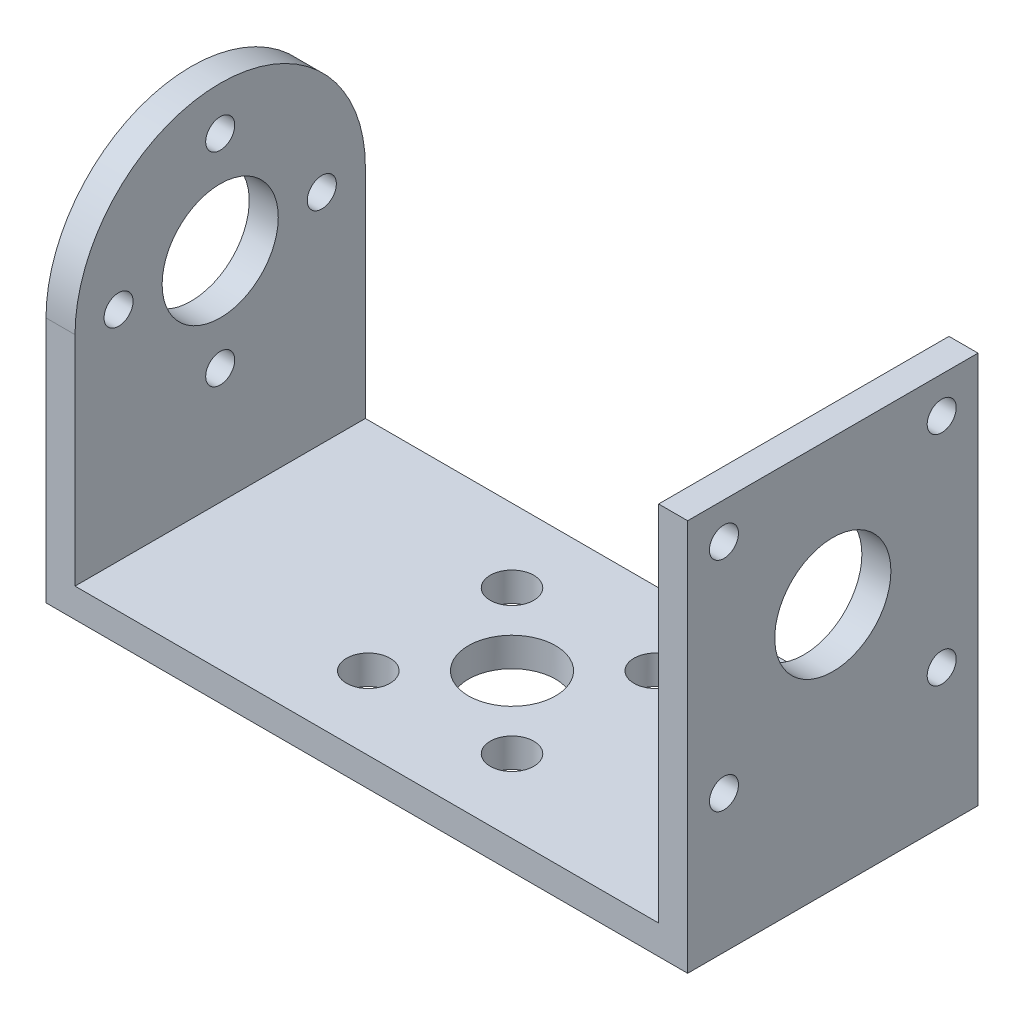
from build123d import *

# Parameters (mm, degrees)
SKETCH_1_W          = 44.2
SKETCH_1_H          = 20
EXTRUDE_1_DEPTH     = 2
CUT_EXTRUDE_1_REACH = 26.339
SKETCH_2_R          = 3
SKETCH_2_R_2        = 1.5
SKETCH_3_W          = 20
SKETCH_3_H          = 25
EXTRUDE_2_DEPTH     = 2
CUT_EXTRUDE_2_REACH = 54.751
SKETCH_4_R          = 1
CUT_EXTRUDE_3_REACH = 54.751
SKETCH_5_R          = 4
SKETCH_5_R_2        = 1


with BuildPart() as part:
    # 草图1 → 凸台-拉伸1 (new body)
    with BuildSketch(Plane(origin=(0, 0, 0), x_dir=(1, 0, 0), z_dir=(0, 1, 0))):
        Rectangle(SKETCH_1_W, SKETCH_1_H)
    extrude(amount=EXTRUDE_1_DEPTH)

    # 草图2 → 切除-拉伸1 (cut, up to next)
    with BuildSketch(Plane(origin=(0, 2, 0), x_dir=(1, 0, 0), z_dir=(0, 1, 0)), mode=Mode.PRIVATE) as cut_extrude_1_sk1:
        with Locations(Location((0, 0, 0), (0, 0, 270))):
            Circle(SKETCH_2_R)
    cut_extrude_1_tool1 = extrude(cut_extrude_1_sk1.sketch, amount=-CUT_EXTRUDE_1_REACH, mode=Mode.PRIVATE) & part.part
    # 草图2 → 切除-拉伸1 (cut, up to next)
    with BuildSketch(Plane(origin=(0, 2, 0), x_dir=(1, 0, 0), z_dir=(0, 1, 0)), mode=Mode.PRIVATE) as cut_extrude_1_sk2:
        with Locations(Location((4.949747468, -4.949747468, 0), (0, 0, 270))):
            Circle(SKETCH_2_R_2)
    cut_extrude_1_tool2 = extrude(cut_extrude_1_sk2.sketch, amount=-CUT_EXTRUDE_1_REACH, mode=Mode.PRIVATE) & part.part
    # 草图2 → 切除-拉伸1 (cut, up to next)
    with BuildSketch(Plane(origin=(0, 2, 0), x_dir=(1, 0, 0), z_dir=(0, 1, 0)), mode=Mode.PRIVATE) as cut_extrude_1_sk3:
        with Locations(Location((-4.949747468, -4.949747468, 0), (0, 0, 270))):
            Circle(SKETCH_2_R_2)
    cut_extrude_1_tool3 = extrude(cut_extrude_1_sk3.sketch, amount=-CUT_EXTRUDE_1_REACH, mode=Mode.PRIVATE) & part.part
    # 草图2 → 切除-拉伸1 (cut, up to next)
    with BuildSketch(Plane(origin=(0, 2, 0), x_dir=(1, 0, 0), z_dir=(0, 1, 0)), mode=Mode.PRIVATE) as cut_extrude_1_sk4:
        with Locations(Location((-4.949747468, 4.949747468, 0), (0, 0, 270))):
            Circle(SKETCH_2_R_2)
    cut_extrude_1_tool4 = extrude(cut_extrude_1_sk4.sketch, amount=-CUT_EXTRUDE_1_REACH, mode=Mode.PRIVATE) & part.part
    # 草图2 → 切除-拉伸1 (cut, up to next)
    with BuildSketch(Plane(origin=(0, 2, 0), x_dir=(1, 0, 0), z_dir=(0, 1, 0)), mode=Mode.PRIVATE) as cut_extrude_1_sk5:
        with Locations(Location((4.949747468, 4.949747468, 0), (0, 0, 270))):
            Circle(SKETCH_2_R_2)
    cut_extrude_1_tool5 = extrude(cut_extrude_1_sk5.sketch, amount=-CUT_EXTRUDE_1_REACH, mode=Mode.PRIVATE) & part.part
    add(cut_extrude_1_tool1.solids().sort_by_distance((0, 2, 0))[0], mode=Mode.SUBTRACT)
    add(cut_extrude_1_tool2.solids().sort_by_distance((4.949747, 2, 4.949747))[0], mode=Mode.SUBTRACT)
    add(cut_extrude_1_tool3.solids().sort_by_distance((-4.949747, 2, 4.949747))[0], mode=Mode.SUBTRACT)
    add(cut_extrude_1_tool4.solids().sort_by_distance((-4.949747, 2, -4.949747))[0], mode=Mode.SUBTRACT)
    add(cut_extrude_1_tool5.solids().sort_by_distance((4.949747, 2, -4.949747))[0], mode=Mode.SUBTRACT)

    # 草图3 → 凸台-拉伸2 (add)
    with BuildSketch(Plane.ZY.offset(22.1)):
        with Locations((0, 14.5)):
            Rectangle(SKETCH_3_W, SKETCH_3_H)
    extrude_2 = extrude(amount=-EXTRUDE_2_DEPTH)

    # 镜向2: 凸台-拉伸2 across plane
    add(extrude_2.mirror(Plane.ZY))

    # 草图4 → 切除-拉伸2 (cut, up to next)
    with BuildSketch(Plane.ZY.offset(22.1), mode=Mode.PRIVATE) as cut_extrude_2_sk1:
        with BuildLine():
            ThreePointArc((-10, 17), (-7.071067812, 24.071067812), (0, 27))
            Line((0, 27), (-10, 27))
            Line((-10, 27), (-10, 17))
        make_face()
    cut_extrude_2_tool1 = extrude(cut_extrude_2_sk1.sketch, amount=-CUT_EXTRUDE_2_REACH, mode=Mode.PRIVATE) & part.part
    # 草图4 → 切除-拉伸2 (cut, up to next)
    with BuildSketch(Plane.ZY.offset(22.1), mode=Mode.PRIVATE) as cut_extrude_2_sk2:
        with BuildLine():
            Line((10, 27), (0, 27))
            ThreePointArc((0, 27), (7.071067812, 24.071067812), (10, 17))
            Line((10, 17), (10, 27))
        make_face()
    cut_extrude_2_tool2 = extrude(cut_extrude_2_sk2.sketch, amount=-CUT_EXTRUDE_2_REACH, mode=Mode.PRIVATE) & part.part
    # 草图4 → 切除-拉伸2 (cut, up to next)
    with BuildSketch(Plane.ZY.offset(22.1), mode=Mode.PRIVATE) as cut_extrude_2_sk3:
        with BuildLine():
            ThreePointArc((1, 10), (0.707106781, 10.707106781), (0, 11))
            Line((0, 11), (0, 9))
            ThreePointArc((0, 9), (0.707106781, 9.292893219), (1, 10))
        make_face()
    cut_extrude_2_tool3 = extrude(cut_extrude_2_sk3.sketch, amount=-CUT_EXTRUDE_2_REACH, mode=Mode.PRIVATE) & part.part
    # 草图4 → 切除-拉伸2 (cut, up to next)
    with BuildSketch(Plane.ZY.offset(22.1), mode=Mode.PRIVATE) as cut_extrude_2_sk4:
        with BuildLine():
            Line((0, 9), (0, 11))
            ThreePointArc((0, 11), (-1, 10), (0, 9))
        make_face()
    cut_extrude_2_tool4 = extrude(cut_extrude_2_sk4.sketch, amount=-CUT_EXTRUDE_2_REACH, mode=Mode.PRIVATE) & part.part
    # 草图4 → 切除-拉伸2 (cut, up to next)
    with BuildSketch(Plane.ZY.offset(22.1), mode=Mode.PRIVATE) as cut_extrude_2_sk5:
        with BuildLine():
            ThreePointArc((1, 10), (0.707106781, 10.707106781), (0, 11))
            Line((0, 11), (0, 9))
            ThreePointArc((0, 9), (0.707106781, 9.292893219), (1, 10))
        make_face()
    cut_extrude_2_tool5 = extrude(cut_extrude_2_sk5.sketch, amount=-CUT_EXTRUDE_2_REACH, mode=Mode.PRIVATE) & part.part
    # 草图4 → 切除-拉伸2 (cut, up to next)
    with BuildSketch(Plane.ZY.offset(22.1), mode=Mode.PRIVATE) as cut_extrude_2_sk6:
        with BuildLine():
            Line((0, 9), (0, 11))
            ThreePointArc((0, 11), (-1, 10), (0, 9))
        make_face()
    cut_extrude_2_tool6 = extrude(cut_extrude_2_sk6.sketch, amount=-CUT_EXTRUDE_2_REACH, mode=Mode.PRIVATE) & part.part
    # 草图4 → 切除-拉伸2 (cut, up to next)
    with BuildSketch(Plane.ZY.offset(22.1), mode=Mode.PRIVATE) as cut_extrude_2_sk7:
        with BuildLine():
            ThreePointArc((4, 17), (2.828427125, 19.828427125), (0, 21))
            Line((0, 21), (0, 13))
            ThreePointArc((0, 13), (2.828427125, 14.171572875), (4, 17))
        make_face()
    cut_extrude_2_tool7 = extrude(cut_extrude_2_sk7.sketch, amount=-CUT_EXTRUDE_2_REACH, mode=Mode.PRIVATE) & part.part
    # 草图4 → 切除-拉伸2 (cut, up to next)
    with BuildSketch(Plane.ZY.offset(22.1), mode=Mode.PRIVATE) as cut_extrude_2_sk8:
        with BuildLine():
            Line((0, 13), (0, 21))
            ThreePointArc((0, 21), (-4, 17), (0, 13))
        make_face()
    cut_extrude_2_tool8 = extrude(cut_extrude_2_sk8.sketch, amount=-CUT_EXTRUDE_2_REACH, mode=Mode.PRIVATE) & part.part
    # 草图4 → 切除-拉伸2 (cut, up to next)
    with BuildSketch(Plane.ZY.offset(22.1), mode=Mode.PRIVATE) as cut_extrude_2_sk9:
        with BuildLine():
            ThreePointArc((4, 17), (2.828427125, 19.828427125), (0, 21))
            Line((0, 21), (0, 13))
            ThreePointArc((0, 13), (2.828427125, 14.171572875), (4, 17))
        make_face()
    cut_extrude_2_tool9 = extrude(cut_extrude_2_sk9.sketch, amount=-CUT_EXTRUDE_2_REACH, mode=Mode.PRIVATE) & part.part
    # 草图4 → 切除-拉伸2 (cut, up to next)
    with BuildSketch(Plane.ZY.offset(22.1), mode=Mode.PRIVATE) as cut_extrude_2_sk10:
        with BuildLine():
            Line((0, 13), (0, 21))
            ThreePointArc((0, 21), (-4, 17), (0, 13))
        make_face()
    cut_extrude_2_tool10 = extrude(cut_extrude_2_sk10.sketch, amount=-CUT_EXTRUDE_2_REACH, mode=Mode.PRIVATE) & part.part
    # 草图4 → 切除-拉伸2 (cut, up to next)
    with BuildSketch(Plane.ZY.offset(22.1), mode=Mode.PRIVATE) as cut_extrude_2_sk11:
        with Locations((7, 17)):
            Circle(SKETCH_4_R)
    cut_extrude_2_tool11 = extrude(cut_extrude_2_sk11.sketch, amount=-CUT_EXTRUDE_2_REACH, mode=Mode.PRIVATE) & part.part
    # 草图4 → 切除-拉伸2 (cut, up to next)
    with BuildSketch(Plane.ZY.offset(22.1), mode=Mode.PRIVATE) as cut_extrude_2_sk12:
        with Locations((0, 24)):
            Circle(SKETCH_4_R)
    cut_extrude_2_tool12 = extrude(cut_extrude_2_sk12.sketch, amount=-CUT_EXTRUDE_2_REACH, mode=Mode.PRIVATE) & part.part
    # 草图4 → 切除-拉伸2 (cut, up to next)
    with BuildSketch(Plane.ZY.offset(22.1), mode=Mode.PRIVATE) as cut_extrude_2_sk13:
        with Locations((-7, 17)):
            Circle(SKETCH_4_R)
    cut_extrude_2_tool13 = extrude(cut_extrude_2_sk13.sketch, amount=-CUT_EXTRUDE_2_REACH, mode=Mode.PRIVATE) & part.part
    add(cut_extrude_2_tool1.solids().sort_by_distance((-22.1, 24.766321, -7.766321))[0], mode=Mode.SUBTRACT)
    add(cut_extrude_2_tool2.solids().sort_by_distance((-22.1, 24.766321, 7.766321))[0], mode=Mode.SUBTRACT)
    add(cut_extrude_2_tool3.solids().sort_by_distance((-22.1, 10, 0.424413))[0], mode=Mode.SUBTRACT)
    add(cut_extrude_2_tool4.solids().sort_by_distance((-22.1, 10, -0.424413))[0], mode=Mode.SUBTRACT)
    add(cut_extrude_2_tool5.solids().sort_by_distance((-22.1, 10, 0.424413))[0], mode=Mode.SUBTRACT)
    add(cut_extrude_2_tool6.solids().sort_by_distance((-22.1, 10, -0.424413))[0], mode=Mode.SUBTRACT)
    add(cut_extrude_2_tool7.solids().sort_by_distance((-22.1, 17, 1.697653))[0], mode=Mode.SUBTRACT)
    add(cut_extrude_2_tool8.solids().sort_by_distance((-22.1, 17, -1.697653))[0], mode=Mode.SUBTRACT)
    add(cut_extrude_2_tool9.solids().sort_by_distance((-22.1, 17, 1.697653))[0], mode=Mode.SUBTRACT)
    add(cut_extrude_2_tool10.solids().sort_by_distance((-22.1, 17, -1.697653))[0], mode=Mode.SUBTRACT)
    add(cut_extrude_2_tool11.solids().sort_by_distance((-22.1, 17, 7))[0], mode=Mode.SUBTRACT)
    add(cut_extrude_2_tool12.solids().sort_by_distance((-22.1, 24, 0))[0], mode=Mode.SUBTRACT)
    add(cut_extrude_2_tool13.solids().sort_by_distance((-22.1, 17, -7))[0], mode=Mode.SUBTRACT)

    # 草图5 → 切除-拉伸3 (cut, up to next)
    with BuildSketch(Plane(origin=(22.1, 0, 0), x_dir=(0, 0, -1), z_dir=(1, 0, 0)), mode=Mode.PRIVATE) as cut_extrude_3_sk1:
        with Locations(Location((0, 17, 0), (0, 0, 180))):
            Circle(SKETCH_5_R)
    cut_extrude_3_tool1 = extrude(cut_extrude_3_sk1.sketch, amount=-CUT_EXTRUDE_3_REACH, mode=Mode.PRIVATE) & part.part
    # 草图5 → 切除-拉伸3 (cut, up to next)
    with BuildSketch(Plane(origin=(22.1, 0, 0), x_dir=(0, 0, -1), z_dir=(1, 0, 0)), mode=Mode.PRIVATE) as cut_extrude_3_sk2:
        with Locations((-7.5, 24.5)):
            Circle(SKETCH_5_R_2)
    cut_extrude_3_tool2 = extrude(cut_extrude_3_sk2.sketch, amount=-CUT_EXTRUDE_3_REACH, mode=Mode.PRIVATE) & part.part
    # 草图5 → 切除-拉伸3 (cut, up to next)
    with BuildSketch(Plane(origin=(22.1, 0, 0), x_dir=(0, 0, -1), z_dir=(1, 0, 0)), mode=Mode.PRIVATE) as cut_extrude_3_sk3:
        with Locations((7.5, 24.5)):
            Circle(SKETCH_5_R_2)
    cut_extrude_3_tool3 = extrude(cut_extrude_3_sk3.sketch, amount=-CUT_EXTRUDE_3_REACH, mode=Mode.PRIVATE) & part.part
    # 草图5 → 切除-拉伸3 (cut, up to next)
    with BuildSketch(Plane(origin=(22.1, 0, 0), x_dir=(0, 0, -1), z_dir=(1, 0, 0)), mode=Mode.PRIVATE) as cut_extrude_3_sk4:
        with Locations((7.5, 9.5)):
            Circle(SKETCH_5_R_2)
    cut_extrude_3_tool4 = extrude(cut_extrude_3_sk4.sketch, amount=-CUT_EXTRUDE_3_REACH, mode=Mode.PRIVATE) & part.part
    # 草图5 → 切除-拉伸3 (cut, up to next)
    with BuildSketch(Plane(origin=(22.1, 0, 0), x_dir=(0, 0, -1), z_dir=(1, 0, 0)), mode=Mode.PRIVATE) as cut_extrude_3_sk5:
        with Locations((-7.5, 9.5)):
            Circle(SKETCH_5_R_2)
    cut_extrude_3_tool5 = extrude(cut_extrude_3_sk5.sketch, amount=-CUT_EXTRUDE_3_REACH, mode=Mode.PRIVATE) & part.part
    add(cut_extrude_3_tool1.solids().sort_by_distance((22.1, 17, 0))[0], mode=Mode.SUBTRACT)
    add(cut_extrude_3_tool2.solids().sort_by_distance((22.1, 24.5, 7.5))[0], mode=Mode.SUBTRACT)
    add(cut_extrude_3_tool3.solids().sort_by_distance((22.1, 24.5, -7.5))[0], mode=Mode.SUBTRACT)
    add(cut_extrude_3_tool4.solids().sort_by_distance((22.1, 9.5, -7.5))[0], mode=Mode.SUBTRACT)
    add(cut_extrude_3_tool5.solids().sort_by_distance((22.1, 9.5, 7.5))[0], mode=Mode.SUBTRACT)


solid = part.part
